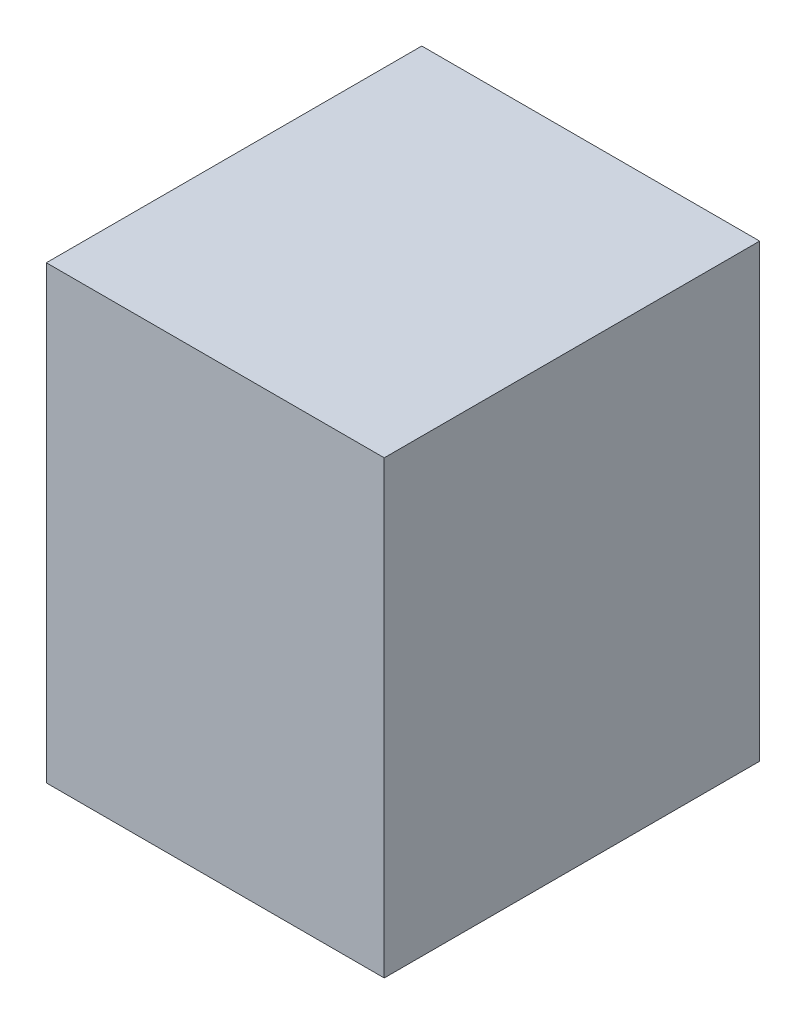
from build123d import *

# Parameters (mm, degrees)
SKETCH1_W           = 57.15
SKETCH1_H           = 76.2
BOSS_EXTRUDE1_DEPTH = 63.5
SKETCH2_R           = 22.225
CUT_EXTRUDE1_DEPTH  = 29.21


with BuildPart() as part:
    # Sketch1 → Boss-Extrude1 (new body)
    with BuildSketch(Plane.XY):
        with Locations((28.575, 38.1)):
            Rectangle(SKETCH1_W, SKETCH1_H)
    extrude(amount=BOSS_EXTRUDE1_DEPTH)

    # Sketch2 → Cut-Extrude1 (cut)
    with BuildSketch(Plane(origin=(0, 0, 0), x_dir=(-1, 0, 0), z_dir=(0, 0, -1))):
        with Locations((-28.575, 38.1)):
            Circle(SKETCH2_R)
    extrude(amount=-CUT_EXTRUDE1_DEPTH, mode=Mode.SUBTRACT)


solid = part.part
